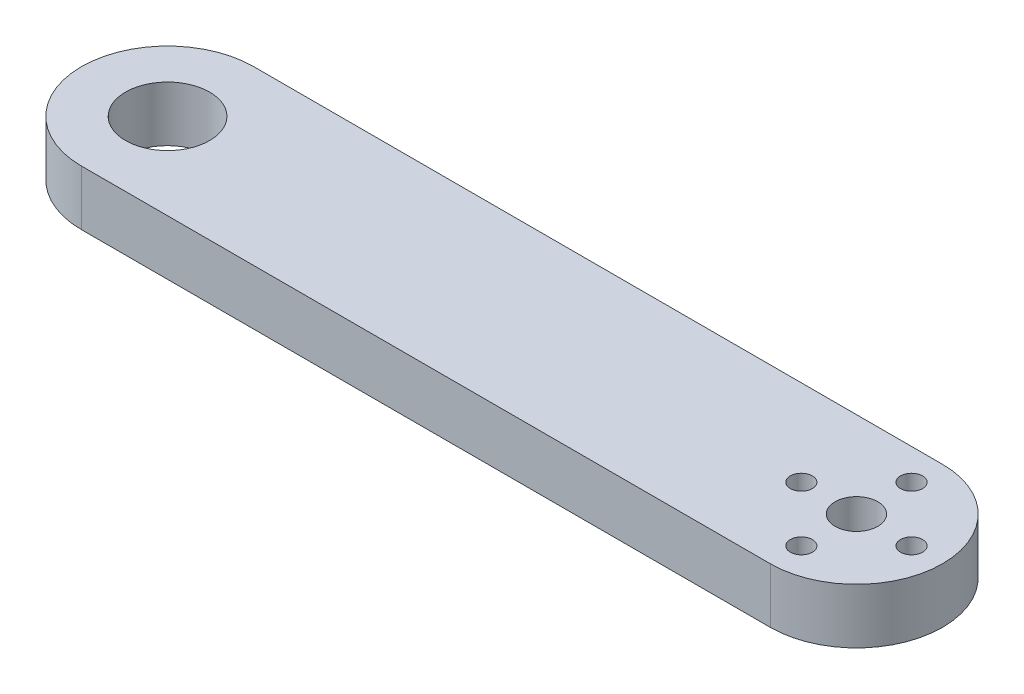
from build123d import *

# Parameters (mm, degrees)
EXTRUDE_1_DEPTH     = 8
SKETCH_3_R          = 3.1
SKETCH_3_R_2        = 1.6
CUT_EXTRUDE_1_DEPTH = 65.237839316
SKETCH_4_R          = 6.1
CUT_EXTRUDE_2_DEPTH = 65.237839316


with BuildPart() as part:
    # 草图1 → 凸台-拉伸1 (new body)
    with BuildSketch(Plane(origin=(0, 0, 0), x_dir=(1, 0, 0), z_dir=(0, 1, 0))):
        with BuildLine():
            Line((-50, -12.5), (50, -12.5))
            ThreePointArc((50, -12.5), (62.5, 0), (50, 12.5))
            Line((50, 12.5), (-50, 12.5))
            ThreePointArc((-50, 12.5), (-62.5, 0), (-50, -12.5))
        make_face()
    extrude(amount=EXTRUDE_1_DEPTH)

    # 草图3 → 切除-拉伸1 (cut, through all)
    with BuildSketch(Plane(origin=(0, 8, 0), x_dir=(1, 0, 0), z_dir=(0, 1, 0))):
        with Locations(Location((-50, 0, 0), (0, 0, 270))):
            Circle(SKETCH_3_R)
        with Locations(Location((50, 8, 0), (0, 0, 270))):
            Circle(SKETCH_3_R_2)
        with Locations(Location((58, 0, 0), (0, 0, 270))):
            Circle(SKETCH_3_R_2)
        with Locations(Location((50, -8, 0), (0, 0, 270))):
            Circle(SKETCH_3_R_2)
        with Locations(Location((42, 0, 0), (0, 0, 270))):
            Circle(SKETCH_3_R_2)
        with Locations(Location((50, 0, 0), (0, 0, 270))):
            Circle(SKETCH_3_R)
    extrude(amount=-CUT_EXTRUDE_1_DEPTH, mode=Mode.SUBTRACT)

    # 草图4 → 切除-拉伸2 (cut, through all)
    with BuildSketch(Plane(origin=(0, 8, 0), x_dir=(1, 0, 0), z_dir=(0, 1, 0))):
        with Locations(Location((-50, 0, 0), (0, 0, 270))):
            Circle(SKETCH_4_R)
    extrude(amount=-CUT_EXTRUDE_2_DEPTH, mode=Mode.SUBTRACT)


solid = part.part
